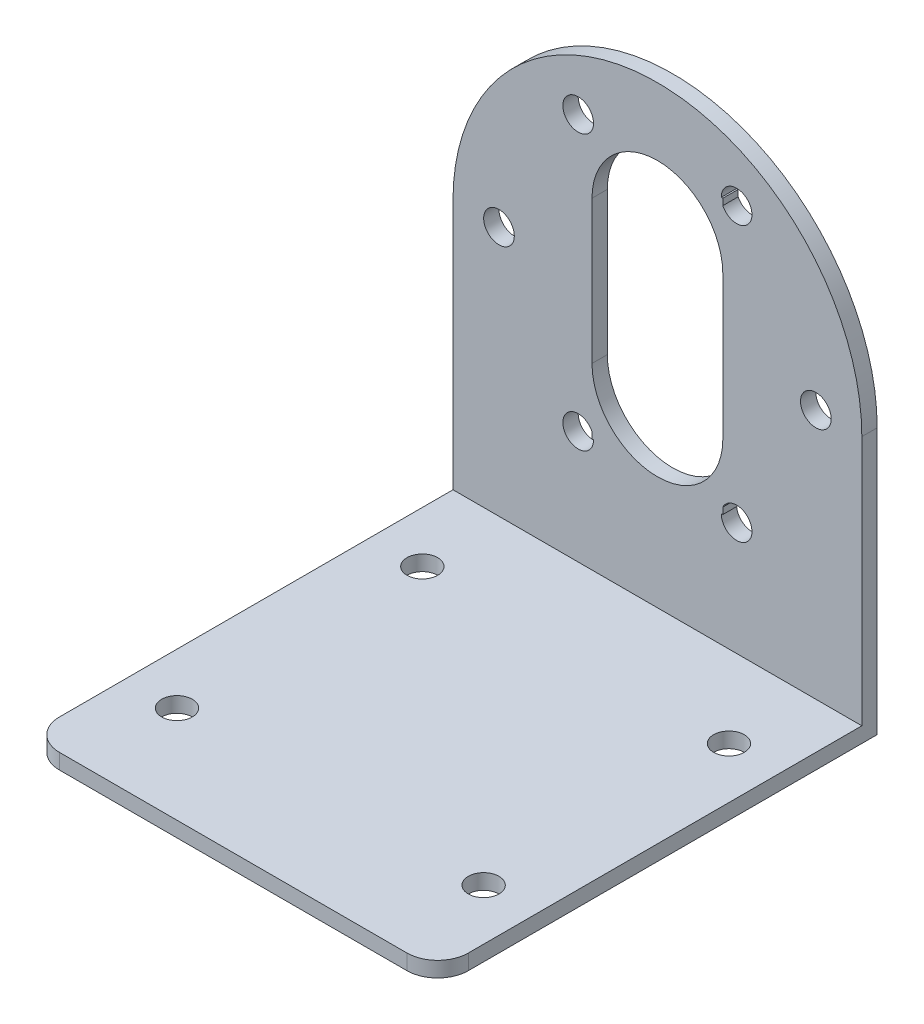
from build123d import *

# Parameters (mm, degrees)
SALIENTE_EXTRUIR1_DEPTH = 1.5
CROQUIS2_W              = 40
CROQUIS2_H              = 1.5
SALIENTE_EXTRUIR2_DEPTH = 41.5
CROQUIS3_R              = 1.5
CORTAR_EXTRUIR1_DEPTH   = 41.5
CROQUIS4_R              = 1.5
CORTAR_EXTRUIR2_DEPTH   = 41.5
FILLET1_R               = 3


with BuildPart() as part:
    # Croquis1 → Saliente-Extruir1 (new body)
    with BuildSketch(Plane.XY):
        with BuildLine():
            Line((0, 0), (40, 0))
            Line((40, 0), (40, 26))
            ThreePointArc((40, 26), (20, 46), (0, 26))
            Line((0, 26), (0, 0))
        make_face()
    extrude(amount=SALIENTE_EXTRUIR1_DEPTH)

    # Croquis2 → Saliente-Extruir2 (add)
    with BuildSketch(Plane.XY.offset(1.5)):
        with Locations((20, 0.75)):
            Rectangle(CROQUIS2_W, CROQUIS2_H)
    extrude(amount=SALIENTE_EXTRUIR2_DEPTH)

    # Croquis3 → Cortar-Extruir1 (cut)
    with BuildSketch(Plane(origin=(0, 1.5, 0), x_dir=(1, 0, 0), z_dir=(0, 1, 0))):
        with Locations(Location((5, -33.5, 0), (0, 0, 270))):
            Circle(CROQUIS3_R)
        with Locations(Location((5, -9.5, 0), (0, 0, 270))):
            Circle(CROQUIS3_R)
        with Locations(Location((35, -9.5, 0), (0, 0, 270))):
            Circle(CROQUIS3_R)
        with Locations(Location((35, -33.5, 0), (0, 0, 270))):
            Circle(CROQUIS3_R)
    extrude(amount=-CORTAR_EXTRUIR1_DEPTH, mode=Mode.SUBTRACT)

    # Croquis4 → Cortar-Extruir2 (cut)
    with BuildSketch(Plane.XY.offset(1.5)):
        with BuildLine():
            ThreePointArc((26.4, 33), (20, 39.4), (13.6, 33))
            Line((13.6, 33), (13.6, 19))
            ThreePointArc((13.6, 19), (20, 12.6), (26.4, 19))
            Line((26.4, 19), (26.4, 33))
        make_face()
        with Locations((12.25, 39.423393759)):
            Circle(CROQUIS4_R)
        with BuildLine():
            Line((13.749817566, 12.6), (13.6, 12.6))
            Line((13.6, 12.6), (13.6, 13.230441083))
            ThreePointArc((13.6, 13.230441083), (10.790640884, 12.229805189), (13.749817566, 12.6))
        make_face()
        with BuildLine():
            Line((26.250182434, 39.4), (26.4, 39.4))
            Line((26.4, 39.4), (26.4, 38.769558917))
            ThreePointArc((26.4, 38.769558917), (29.209359116, 39.770194811), (26.250182434, 39.4))
        make_face()
        with BuildLine():
            Line((26.4, 12.6), (26.250182434, 12.6))
            ThreePointArc((26.250182434, 12.6), (29.209359116, 12.229805189), (26.4, 13.230441083))
            Line((26.4, 13.230441083), (26.4, 12.6))
        make_face()
        with Locations((4.5, 26)):
            Circle(CROQUIS4_R)
        with Locations((35.5, 26)):
            Circle(CROQUIS4_R)
    extrude(amount=-CORTAR_EXTRUIR2_DEPTH, mode=Mode.SUBTRACT)

    # Fillet1
    fillet1_edges = [part.edges().sort_by_distance(p)[0] for p in [
        (0, 0.75, 43),
        (40, 0.75, 43),
    ]]
    fillet(fillet1_edges, radius=FILLET1_R)


solid = part.part
